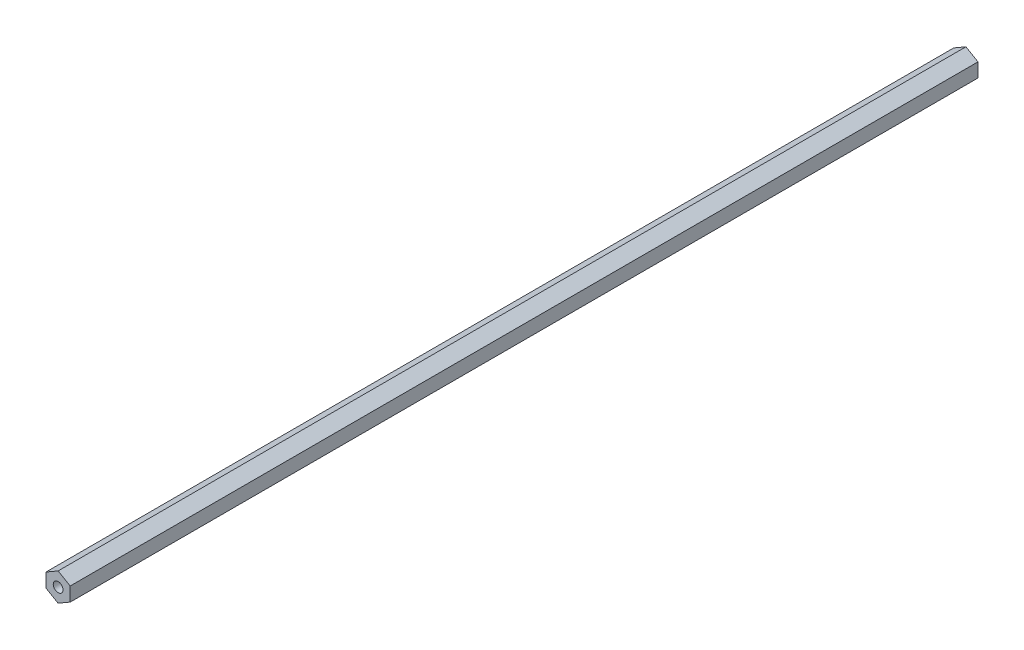
from build123d import *

# Parameters (mm, degrees)
BOSS_EXTRUDE1_DEPTH             = 238.125
TAP_DRILL_FOR_1_4_20_TAP1_D     = 5.1054
TAP_DRILL_FOR_1_4_20_TAP1_DEPTH = 25.4
TAP_DRILL_FOR_1_4_20_TAP1_TIP   = 1.533816902
TAP_DRILL_FOR_1_4_20_TAP2_D     = 5.1054
TAP_DRILL_FOR_1_4_20_TAP2_DEPTH = 25.4
TAP_DRILL_FOR_1_4_20_TAP2_TIP   = 1.533816902


with BuildPart() as part:
    # Sketch3 → Boss-Extrude1 (new, symmetric)
    with BuildSketch(Plane.XY):
        Polygon((0, 7.332348419), (6.35, 3.666174209), (6.35, -3.666174209), (0, -7.332348419), (-6.35, -3.666174209), (-6.35, 3.666174209), align=None)
    extrude(amount=BOSS_EXTRUDE1_DEPTH, both=True)

    # Tap Drill for 1/4-20 Tap1
    with Locations(Plane.XY.offset(238.125)):
        with Locations((0, 0)):
            Hole(TAP_DRILL_FOR_1_4_20_TAP1_D / 2, depth=TAP_DRILL_FOR_1_4_20_TAP1_DEPTH)
            with Locations((0, 0, -(TAP_DRILL_FOR_1_4_20_TAP1_DEPTH + TAP_DRILL_FOR_1_4_20_TAP1_TIP / 2))):  # 118° drill point
                Cone(0, TAP_DRILL_FOR_1_4_20_TAP1_D / 2, TAP_DRILL_FOR_1_4_20_TAP1_TIP, mode=Mode.SUBTRACT)

    # Tap Drill for 1/4-20 Tap2
    with Locations(Plane(origin=(0, 0, -238.125), x_dir=(-1, 0, 0), z_dir=(0, 0, -1))):
        with Locations((0, 0)):
            Hole(TAP_DRILL_FOR_1_4_20_TAP2_D / 2, depth=TAP_DRILL_FOR_1_4_20_TAP2_DEPTH)
            with Locations((0, 0, -(TAP_DRILL_FOR_1_4_20_TAP2_DEPTH + TAP_DRILL_FOR_1_4_20_TAP2_TIP / 2))):  # 118° drill point
                Cone(0, TAP_DRILL_FOR_1_4_20_TAP2_D / 2, TAP_DRILL_FOR_1_4_20_TAP2_TIP, mode=Mode.SUBTRACT)


solid = part.part
